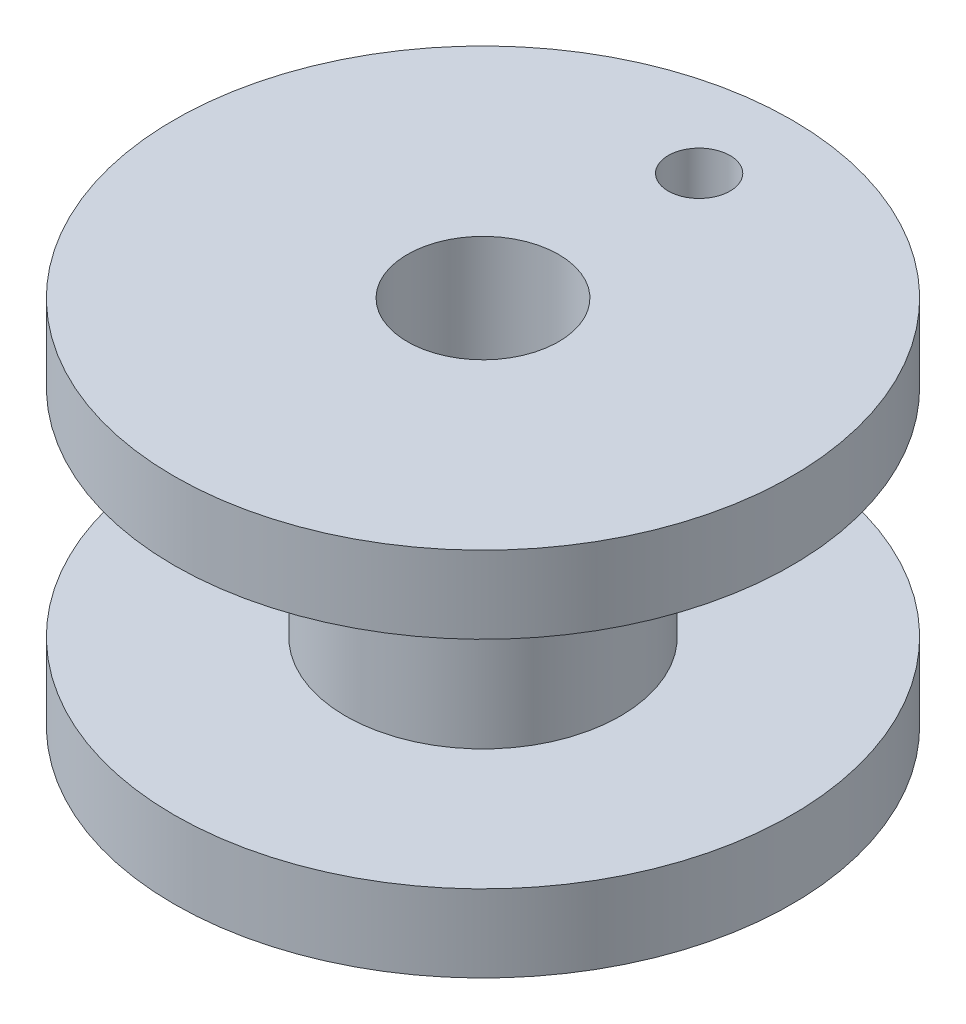
from build123d import *

# Parameters (mm, degrees)
SKETCH1_R           = 5.6515
SKETCH1_R_2         = 3.1115
BOSS_EXTRUDE1_DEPTH = 7.62
SKETCH1_4_R         = 12.7
SKETCH1_4_R_2       = 5.6515
SKETCH1_4_R_3       = 1.27
BOSS_EXTRUDE2_DEPTH = 3.175


with BuildPart() as part:
    # Sketch1 → Boss-Extrude1 (new body)
    with BuildSketch(Plane(origin=(0, 0, 0), x_dir=(1, 0, 0), z_dir=(0, 1, 0))):
        Circle(SKETCH1_R)
        Circle(SKETCH1_R_2, mode=Mode.SUBTRACT)
    boss_extrude1 = extrude(amount=BOSS_EXTRUDE1_DEPTH)

    # Sketch1<4> → Boss-Extrude2 (add)
    with BuildSketch(Plane(origin=(0, 0, 0), x_dir=(1, 0, 0), z_dir=(0, 1, 0))):
        Circle(SKETCH1_4_R)
        Circle(SKETCH1_4_R_2, mode=Mode.SUBTRACT)
        with Locations((0, 8.89)):
            Circle(SKETCH1_4_R_3, mode=Mode.SUBTRACT)
    boss_extrude2 = extrude(amount=BOSS_EXTRUDE2_DEPTH)

    # Mirror1: Boss-Extrude1, Boss-Extrude2 across plane
    add(boss_extrude1.mirror(Plane.ZX.offset(7.62)))
    add(boss_extrude2.mirror(Plane.ZX.offset(7.62)))


solid = part.part
